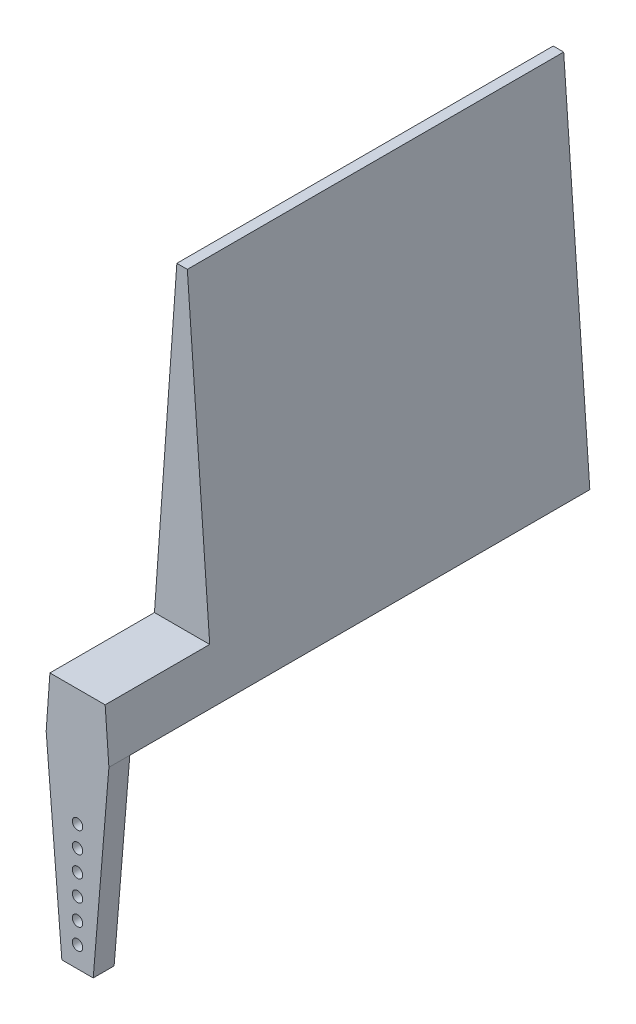
from build123d import *

# Parameters (mm, degrees)
BOSS_EXTRUDE1_DEPTH = 36
BOSS_EXTRUDE3_DEPTH = 10
SKETCH4_R           = 0.5
BOSS_EXTRUDE4_DEPTH = 2


with BuildPart() as part:
    # Sketch1 → Boss-Extrude1 (new body)
    with BuildSketch(Plane.XY):
        Polygon((63.072235962, 55.72786335), (64.072235962, 55.72786335), (66.572235962, 20.72786335), (60.572235962, 20.72786335), align=None)
    extrude(amount=-BOSS_EXTRUDE1_DEPTH)

    # Sketch3 → Boss-Extrude3 (add)
    with BuildSketch(Plane.XY):
        Polygon((60.572235962, 20.72786335), (60.929378819, 25.72786335), (66.215093105, 25.72786335), (66.572235962, 20.72786335), align=None)
    extrude(amount=BOSS_EXTRUDE3_DEPTH)

    # Sketch4 → Boss-Extrude4 (add)
    with BuildSketch(Plane.XY.offset(10)):
        Polygon((66.572235962, 20.72786335), (60.572235962, 20.72786335), (62.072235962, 2.52786335), (65.072235962, 2.52786335), align=None)
        with Locations(Location((63.572235962, 14.52786335, 0), (0, 0, 180))):
            Circle(SKETCH4_R, mode=Mode.SUBTRACT)
        with Locations(Location((63.572235962, 12.52786335, 0), (0, 0, 180))):
            Circle(SKETCH4_R, mode=Mode.SUBTRACT)
        with Locations(Location((63.572235962, 10.52786335, 0), (0, 0, 180))):
            Circle(SKETCH4_R, mode=Mode.SUBTRACT)
        with Locations(Location((63.572235962, 8.52786335, 0), (0, 0, 180))):
            Circle(SKETCH4_R, mode=Mode.SUBTRACT)
        with Locations(Location((63.572235962, 4.52786335, 0), (0, 0, 180))):
            Circle(SKETCH4_R, mode=Mode.SUBTRACT)
        with Locations(Location((63.572235962, 6.52786335, 0), (0, 0, 180))):
            Circle(SKETCH4_R, mode=Mode.SUBTRACT)
    extrude(amount=-BOSS_EXTRUDE4_DEPTH)


solid = part.part
